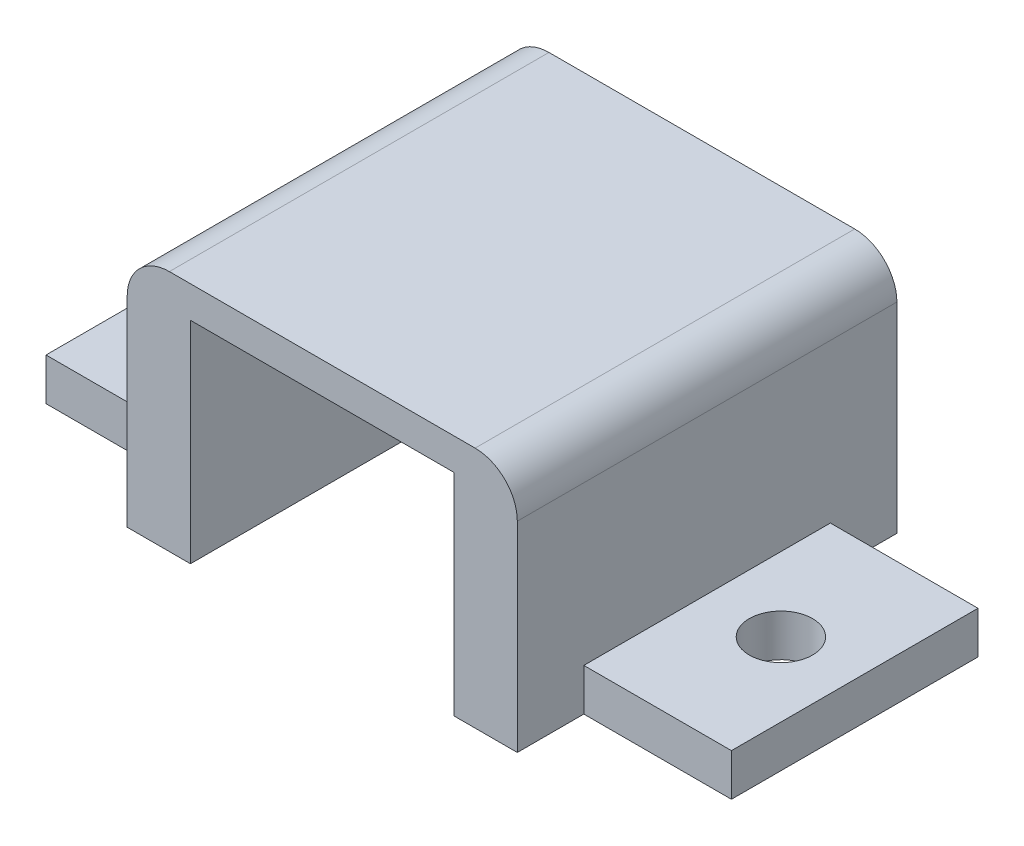
from build123d import *

# Parameters (mm, degrees)
BOSS_EXTRUDE1_DEPTH       = 18
SKETCH3_W                 = 11.692277346
SKETCH3_H                 = 2
BOSS_EXTRUDE2_DEPTH       = 7
SKETCH4_W                 = 11.7
SKETCH4_H                 = 2
BOSS_EXTRUDE3_DEPTH       = 7
F_3_0MM_DOWEL_HOLE1_D     = 3
F_3_0MM_DOWEL_HOLE1_DEPTH = 12
F_3_0MM_DOWEL_HOLE1_TIP   = 0.901290929


with BuildPart() as part:
    # Sketch2 → Boss-Extrude1 (new body)
    with BuildSketch(Plane.XY):
        with BuildLine():
            Line((-9.25, 0), (-9.25, 9.5))
            ThreePointArc((-9.25, 9.5), (-8.664213562, 10.914213562), (-7.25, 11.5))
            Line((-7.25, 11.5), (7.25, 11.5))
            ThreePointArc((7.25, 11.5), (8.664213562, 10.914213562), (9.25, 9.5))
            Line((9.25, 9.5), (9.25, 0))
            Line((9.25, 0), (6.25, 0))
            Line((6.25, 0), (6.25, 10))
            Line((6.25, 10), (-6.25, 10))
            Line((-6.25, 10), (-6.25, 0))
            Line((-6.25, 0), (-9.25, 0))
        make_face()
    extrude(amount=BOSS_EXTRUDE1_DEPTH)

    # Sketch3 → Boss-Extrude2 (add)
    with BuildSketch(Plane(origin=(9.25, 0, 0), x_dir=(0, 0, -1), z_dir=(1, 0, 0))):
        with Locations((-9, 1)):
            Rectangle(SKETCH3_W, SKETCH3_H)
    extrude(amount=BOSS_EXTRUDE2_DEPTH)

    # Sketch4 → Boss-Extrude3 (add)
    with BuildSketch(Plane.ZY.offset(9.25)):
        with Locations((9, 1)):
            Rectangle(SKETCH4_W, SKETCH4_H)
    extrude(amount=BOSS_EXTRUDE3_DEPTH)

    # Ø3.0mm Dowel Hole1
    with Locations(Plane.XZ):
        with Locations((12.75, 9), (-12.75, 9)):
            Hole(F_3_0MM_DOWEL_HOLE1_D / 2, depth=F_3_0MM_DOWEL_HOLE1_DEPTH)
            with Locations((0, 0, -(F_3_0MM_DOWEL_HOLE1_DEPTH + F_3_0MM_DOWEL_HOLE1_TIP / 2))):  # 118° drill point
                Cone(0, F_3_0MM_DOWEL_HOLE1_D / 2, F_3_0MM_DOWEL_HOLE1_TIP, mode=Mode.SUBTRACT)


solid = part.part
